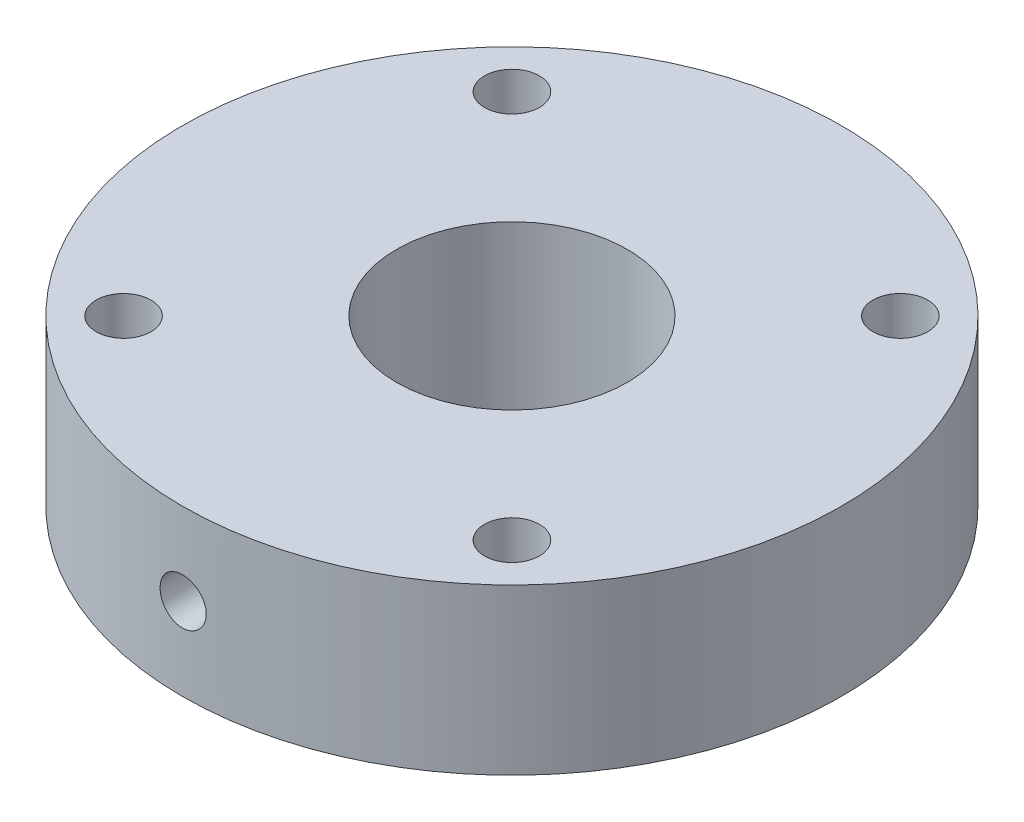
from build123d import *

# Parameters (mm, degrees)
BOSS_EXTRUDE1_DEPTH      = 7.5
BOSS_EXTRUDE1_DEPTH_BACK = 7.5
SKETCH1_R                = 30
SKETCH1_R_2              = 10.5
SKETCH1_R_3              = 2.5
CUT_EXTRUDE2_START       = 20
SKETCH2_R                = 2.1
CUT_EXTRUDE2_DEPTH       = 10


with BuildPart() as part:
    # Sketch1 → Boss-Extrude1 (new, two sides: drawn at the far end of the back side and taken through both)
    with BuildSketch(Plane(origin=(0, 0, 0), x_dir=(1, 0, 0), z_dir=(0, 1, 0)).offset(-BOSS_EXTRUDE1_DEPTH_BACK)):
        Circle(SKETCH1_R)
        Circle(SKETCH1_R_2, mode=Mode.SUBTRACT)
        with Locations((17.67766953, 17.67766953)):
            Circle(SKETCH1_R_3, mode=Mode.SUBTRACT)
        with Locations((17.67766953, -17.67766953)):
            Circle(SKETCH1_R_3, mode=Mode.SUBTRACT)
        with Locations((-17.67766953, -17.67766953)):
            Circle(SKETCH1_R_3, mode=Mode.SUBTRACT)
        with Locations((-17.67766953, 17.67766953)):
            Circle(SKETCH1_R_3, mode=Mode.SUBTRACT)
    extrude(amount=BOSS_EXTRUDE1_DEPTH + BOSS_EXTRUDE1_DEPTH_BACK)

    # Sketch2 → Cut-Extrude2 (cut)
    with BuildSketch(Plane.XY.offset(CUT_EXTRUDE2_START)):
        Circle(SKETCH2_R)
    extrude(amount=CUT_EXTRUDE2_DEPTH, mode=Mode.SUBTRACT)


solid = part.part
